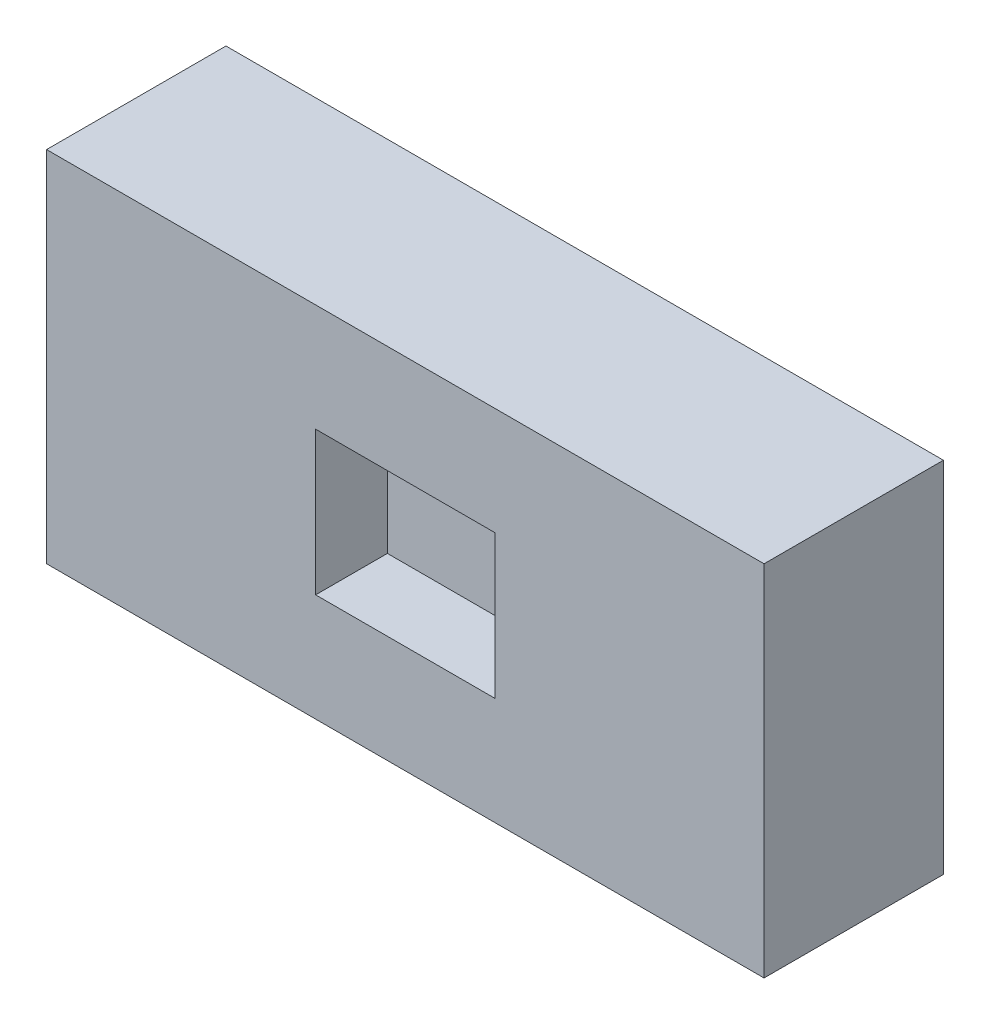
from build123d import *

# Parameters (mm, degrees)
RECTANGLESKETCH_W = 40
RECTANGLESKETCH_H = 20
BLINDBOSS_DEPTH   = 10
CUTSKETCH_W       = 10
CUTSKETCH_H       = 8
BLINDCUT_DEPTH    = 4


with BuildPart() as part:
    # RectangleSketch → BlindBoss (new body)
    with BuildSketch(Plane.XY):
        with Locations((20, 10)):
            Rectangle(RECTANGLESKETCH_W, RECTANGLESKETCH_H)
    extrude(amount=BLINDBOSS_DEPTH)

    # CutSketch → BlindCut (cut)
    with BuildSketch(Plane.XY.offset(10)):
        with Locations((20, 10)):
            Rectangle(CUTSKETCH_W, CUTSKETCH_H)
    extrude(amount=-BLINDCUT_DEPTH, mode=Mode.SUBTRACT)


solid = part.part
